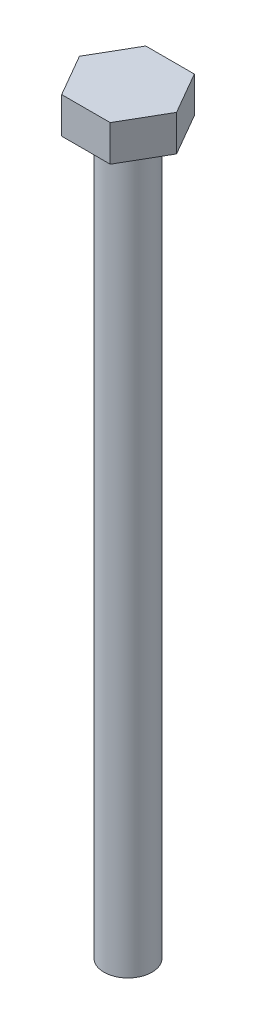
from build123d import *

# Parameters (mm, degrees)
SKETCH1_R           = 2
BOSS_EXTRUDE1_DEPTH = 60
BOSS_EXTRUDE2_DEPTH = 3


with BuildPart() as part:
    # Sketch1 → Boss-Extrude1 (new body)
    with BuildSketch(Plane(origin=(0, 0, 0), x_dir=(1, 0, 0), z_dir=(0, 1, 0))):
        with Locations(Location((0, 0, 0), (0, 0, 270))):
            Circle(SKETCH1_R)
    extrude(amount=BOSS_EXTRUDE1_DEPTH)

    # Sketch2 → Boss-Extrude2 (add)
    with BuildSketch(Plane(origin=(0, 60, 0), x_dir=(1, 0, 0), z_dir=(0, 1, 0))):
        Polygon((4.041451884, 0), (2.020725942, 3.5), (-2.020725942, 3.5), (-4.041451884, 0), (-2.020725942, -3.5), (2.020725942, -3.5), align=None)
    extrude(amount=BOSS_EXTRUDE2_DEPTH)


solid = part.part
